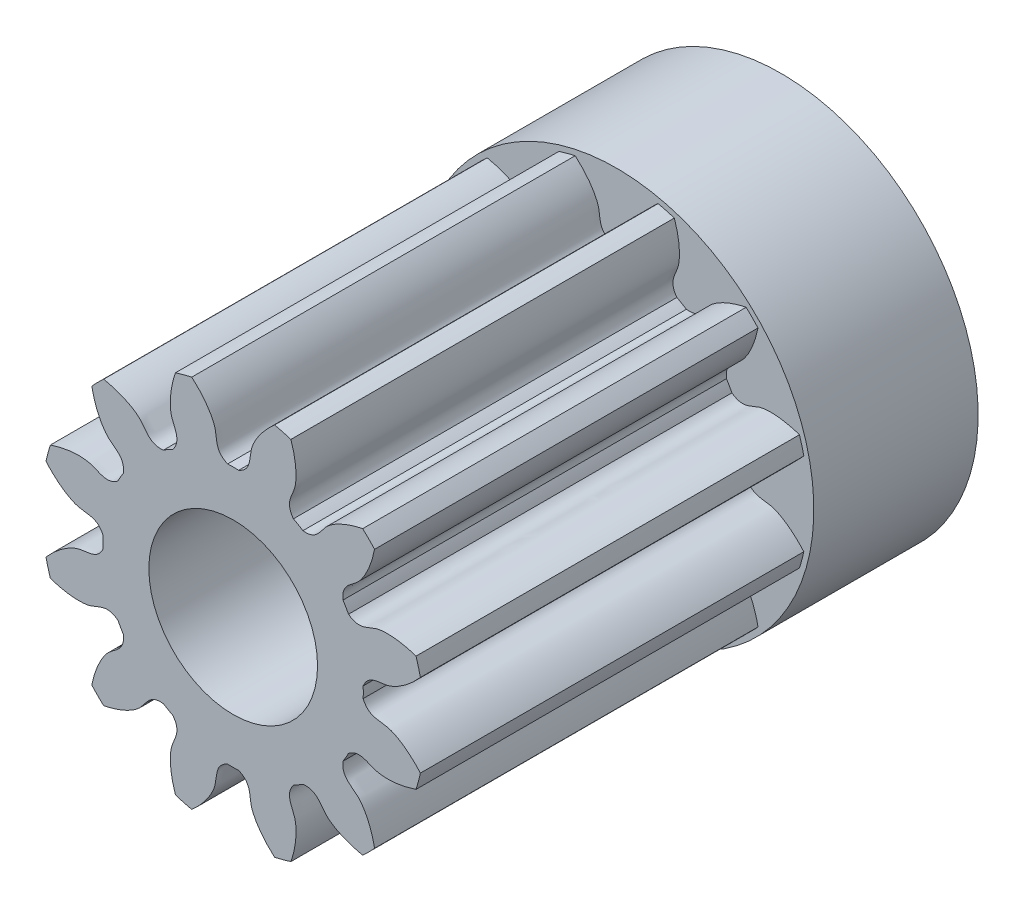
from build123d import *

# Parameters (mm, degrees)
SKETCH_1_R               = 3.5
EXTRUDE_1_DEPTH          = 7
CUT_EXTRUDE_1_DEPTH      = 9.5732141
PATTERN_CIRCULAR_1_COUNT = 12
SKETCH_5_R               = 3.6
EXTRUDE_2_DEPTH          = 3
CUT_EXTRUDE_2_REACH      = 13.221
SKETCH_4_R               = 1.54
CUT_EXTRUDE_3_REACH      = 10.656
SKETCH_6_R               = 0.825


with BuildPart() as part:
    # 草图1 → 凸台-拉伸1 (new body)
    with BuildSketch(Plane.XY):
        Circle(SKETCH_1_R)
    extrude(amount=EXTRUDE_1_DEPTH)

    # 草图2 → 切除-拉伸1 (cut, through all)
    with BuildSketch(Plane.XY):
        with BuildLine():
            ThreePointArc((0.100420056, 2.372876063), (0, 2.375), (-0.100420056, 2.372876063))
            add(Edge.make_bspline(
                [(-0.100420056, 2.372876063), (-0.340394435, 2.474653731), (-0.287186739, 2.672409341), (-0.338076094, 2.844740289), (-0.341311927, 2.854952869), (-0.345113625, 2.866166713), (-0.349521434, 2.878363044), (-0.354576313, 2.891521619), (-0.360318258, 2.905621034), (-0.36678678, 2.920638648), (-0.374020716, 2.936550626), (-0.382058239, 2.95333195), (-0.390936819, 2.970956436), (-0.400693193, 2.989396753), (-0.411363332, 3.008624444), (-0.422982412, 3.02860994), (-0.435584786, 3.049322589), (-0.449203949, 3.07073067), (-0.463872517, 3.092801417), (-0.479622192, 3.115501045), (-0.496483738, 3.138794769), (-0.514486952, 3.162646832), (-0.533660639, 3.187020528), (-0.554032585, 3.211878226), (-0.575629533, 3.237181399), (-0.598477155, 3.262890651), (-0.622600033, 3.288965742), (-0.648021632, 3.315365616), (-0.674764279, 3.342048434), (-0.702849139, 3.368971597), (-0.732296196, 3.396091781), (-0.763124233, 3.423364967), (-0.795350811, 3.450746465), (-0.828992247, 3.478190957), (-0.864063604, 3.505652518), (-0.900578664, 3.533084654), (-0.938549918, 3.560440334), (-0.977988547, 3.587672024), (-1.01890441, 3.614731718), (-1.061306025, 3.641570973), (-1.10520056, 3.668140947), (-1.150593819, 3.694392428), (-1.197490231, 3.720275872), (-1.245892835, 3.74574144), (-1.295803277, 3.770739031), (-1.347221796, 3.79521832), (-1.400147219, 3.819128792), (-1.454576948, 3.842419781), (-1.510506963, 3.865040505), (-1.567931802, 3.886940103), (-1.647189853, 3.915363979), (-1.7077968, 3.935050704), (-1.748802701, 3.947485455)],
                knots=[0, 0, 0, 0, 0.218015236, 0.222043642, 0.226545979, 0.231522246, 0.236972443, 0.24289657, 0.249294627, 0.256166614, 0.263512532, 0.271332379, 0.279626157, 0.288393865, 0.297635503, 0.307351072, 0.31754057, 0.328203999, 0.339341357, 0.350952646, 0.363037866, 0.375597015, 0.388630094, 0.402137104, 0.416118043, 0.430572913, 0.445501713, 0.460904444, 0.476781104, 0.493131694, 0.509956215, 0.527254666, 0.545027047, 0.563273358, 0.581993599, 0.601187771, 0.620855872, 0.640997904, 0.661613866, 0.682703758, 0.704267581, 0.726305333, 0.748817015, 0.771802628, 0.795262171, 0.819195644, 0.843603047, 0.868484381, 0.893839644, 0.919668838, 0.945971962, 1, 1, 1, 1], degree=3))
            ThreePointArc((-1.748802701, 3.947485455), (0, 4.317516914), (1.748802701, 3.947485455))
            add(Edge.make_bspline(
                [(0.100420056, 2.372876063), (0.340394435, 2.474653731), (0.287186739, 2.672409341), (0.338076094, 2.844740289), (0.341311927, 2.854952869), (0.345113625, 2.866166713), (0.349521434, 2.878363044), (0.354576313, 2.891521619), (0.360318258, 2.905621034), (0.36678678, 2.920638648), (0.374020716, 2.936550626), (0.382058239, 2.95333195), (0.390936819, 2.970956436), (0.400693193, 2.989396753), (0.411363332, 3.008624444), (0.422982412, 3.02860994), (0.435584786, 3.049322589), (0.449203949, 3.07073067), (0.463872517, 3.092801417), (0.479622192, 3.115501045), (0.496483738, 3.138794769), (0.514486952, 3.162646832), (0.533660639, 3.187020528), (0.554032585, 3.211878226), (0.575629533, 3.237181399), (0.598477155, 3.262890651), (0.622600033, 3.288965742), (0.648021632, 3.315365616), (0.674764279, 3.342048434), (0.702849139, 3.368971597), (0.732296196, 3.396091781), (0.763124233, 3.423364967), (0.795350811, 3.450746465), (0.828992247, 3.478190957), (0.864063604, 3.505652518), (0.900578664, 3.533084654), (0.938549918, 3.560440334), (0.977988547, 3.587672024), (1.01890441, 3.614731718), (1.061306025, 3.641570973), (1.10520056, 3.668140947), (1.150593819, 3.694392428), (1.197490231, 3.720275872), (1.245892835, 3.74574144), (1.295803277, 3.770739031), (1.347221796, 3.79521832), (1.400147219, 3.819128792), (1.454576948, 3.842419781), (1.510506963, 3.865040505), (1.567931802, 3.886940103), (1.647189853, 3.915363979), (1.7077968, 3.935050704), (1.748802701, 3.947485455)],
                knots=[0, 0, 0, 0, 0.218015236, 0.222043642, 0.226545979, 0.231522246, 0.236972443, 0.24289657, 0.249294627, 0.256166614, 0.263512532, 0.271332379, 0.279626157, 0.288393865, 0.297635503, 0.307351072, 0.31754057, 0.328203999, 0.339341357, 0.350952646, 0.363037866, 0.375597015, 0.388630094, 0.402137104, 0.416118043, 0.430572913, 0.445501713, 0.460904444, 0.476781104, 0.493131694, 0.509956215, 0.527254666, 0.545027047, 0.563273358, 0.581993599, 0.601187771, 0.620855872, 0.640997904, 0.661613866, 0.682703758, 0.704267581, 0.726305333, 0.748817015, 0.771802628, 0.795262171, 0.819195644, 0.843603047, 0.868484381, 0.893839644, 0.919668838, 0.945971962, 1, 1, 1, 1], degree=3))
        make_face()
    cut_extrude_1 = extrude(amount=CUT_EXTRUDE_1_DEPTH, mode=Mode.SUBTRACT)

    # 阵列(圆周)1: 切除-拉伸1 ×12 about axis
    pattern_circular_1_axis = Axis((0, 0, 7), (0, 0, -1))
    for i in range(1, PATTERN_CIRCULAR_1_COUNT):
        add(cut_extrude_1.rotate(pattern_circular_1_axis, i * 360 / PATTERN_CIRCULAR_1_COUNT), mode=Mode.SUBTRACT)

    # 草图5 → 凸台-拉伸2 (add)
    with BuildSketch(Plane(origin=(0, 0, 0), x_dir=(-1, 0, 0), z_dir=(0, 0, -1))):
        Circle(SKETCH_5_R)
    extrude(amount=EXTRUDE_2_DEPTH)

    # 草图4 → 切除-拉伸2 (cut, up to next)
    with BuildSketch(Plane.XY.offset(7), mode=Mode.PRIVATE) as cut_extrude_2_sk1:
        Circle(SKETCH_4_R)
    cut_extrude_2_tool1 = extrude(cut_extrude_2_sk1.sketch, amount=-CUT_EXTRUDE_2_REACH, mode=Mode.PRIVATE) & part.part
    add(cut_extrude_2_tool1.solids().sort_by_distance((0, 0, 7))[0], mode=Mode.SUBTRACT)

    # 草图6 → 切除-拉伸3 (cut, up to next)
    with BuildSketch(Plane(origin=(0, 0, 0), x_dir=(1, 0, 0), z_dir=(0, 1, 0)), mode=Mode.PRIVATE) as cut_extrude_3_sk1:
        with Locations((0, 1)):
            Circle(SKETCH_6_R)
    cut_extrude_3_tool1 = extrude(cut_extrude_3_sk1.sketch, amount=-CUT_EXTRUDE_3_REACH, mode=Mode.PRIVATE) & part.part
    add(cut_extrude_3_tool1.solids().sort_by_distance((0, 0, -1))[0], mode=Mode.SUBTRACT)


solid = part.part
